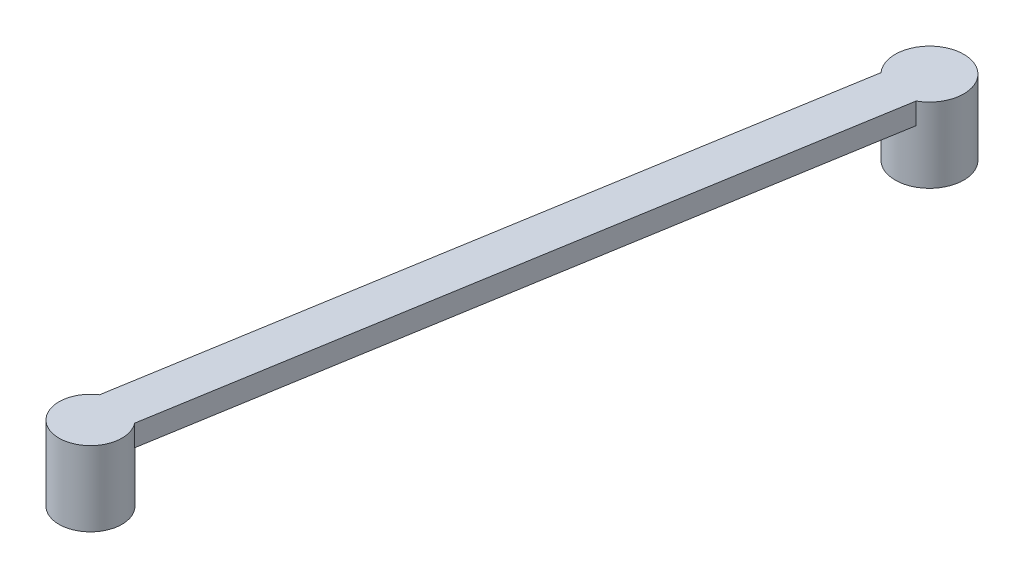
from build123d import *

# Parameters (mm, degrees)
SKETCH1_R           = 1.606483672
SKETCH1_R_2         = 1.474719506
BOSS_EXTRUDE1_DEPTH = 1
BOSS_EXTRUDE2_START = -2.5
SKETCH1_3_R         = 1.474719506
SKETCH1_3_R_2       = 1.606483672
BOSS_EXTRUDE2_DEPTH = 2.5


with BuildPart() as part:
    # Sketch1 → Boss-Extrude1 (new body)
    with BuildSketch(Plane(origin=(0, 0, 0), x_dir=(1, 0, 0), z_dir=(0, 1, 0))):
        with BuildLine():
            ThreePointArc((-516.919741048, 9.197616983), (-515.869047512, 9.418519621), (-514.947021866, 8.868407277))
            Line((-514.947021866, 8.868407277), (-509.711678857, 40.240087315))
            ThreePointArc((-509.711678857, 40.240087315), (-510.755516658, 40.060266208), (-511.684398038, 40.569297021))
            Line((-511.684398038, 40.569297021), (-516.919741048, 9.197616983))
        make_face()
        with Locations((-510.491081649, 41.644836785)):
            Circle(SKETCH1_R)
        with Locations((-516.1117935, 7.963915892)):
            Circle(SKETCH1_R_2)
    extrude(amount=BOSS_EXTRUDE1_DEPTH)

    # Sketch1<3> → Boss-Extrude2 (add)
    with BuildSketch(Plane(origin=(0, 0, 0), x_dir=(1, 0, 0), z_dir=(0, 1, 0)).offset(BOSS_EXTRUDE2_START)):
        with Locations((-516.1117935, 7.963915892)):
            Circle(SKETCH1_3_R)
        with Locations((-510.491081649, 41.644836785)):
            Circle(SKETCH1_3_R_2)
    extrude(amount=BOSS_EXTRUDE2_DEPTH)


solid = part.part
